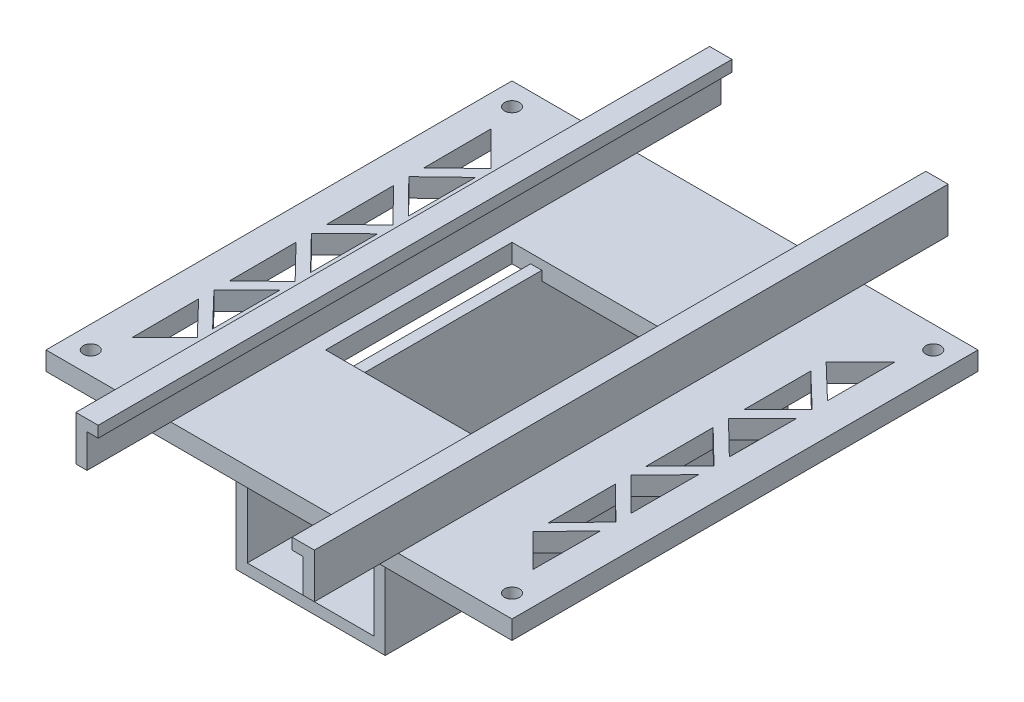
from build123d import *

# Parameters (mm, degrees)
SKETCH_2_W               = 125
SKETCH_2_H               = 125
SKETCH_2_R               = 2
SKETCH_2_W_2             = 50
SKETCH_2_H_2             = 50
EXTRUDE_1_DEPTH          = 2.5
EXTRUDE_4_DEPTH          = 54
CUT_EXTRUDE_2_DEPTH      = 95.702164706
CUT_EXTRUDE_2_DEPTH_BACK = 5
EXTRUDE_7_DEPTH          = 85


with BuildPart() as part:
    # 스케치2 → 보스-돌출1 (new, symmetric)
    with BuildSketch(Plane(origin=(0, 0, 0), x_dir=(1, 0, 0), z_dir=(0, 1, 0))):
        Rectangle(SKETCH_2_W, SKETCH_2_H)
        with Locations((-56.5, 56.5)):
            Circle(SKETCH_2_R, mode=Mode.SUBTRACT)
        with Locations((56.5, 56.5)):
            Circle(SKETCH_2_R, mode=Mode.SUBTRACT)
        with Locations((-56.5, -56.5)):
            Circle(SKETCH_2_R, mode=Mode.SUBTRACT)
        with Locations((56.5, -56.5)):
            Circle(SKETCH_2_R, mode=Mode.SUBTRACT)
        Rectangle(SKETCH_2_W_2, SKETCH_2_H_2, mode=Mode.SUBTRACT)
    extrude(amount=EXTRUDE_1_DEPTH, both=True)

    # 스케치6 → 보스-돌출4 (add, symmetric)
    with BuildSketch(Plane.XY):
        Polygon((-20, 0), (-20, -31.5), (20, -31.5), (20, 0), (17, 0), (17, -28.5), (-17, -28.5), (-17, 0), align=None)
    extrude(amount=EXTRUDE_4_DEPTH, both=True)

    # 스케치8 → 컷-돌출2 (cut, two sides: drawn at the far end of the back side and taken through both)
    with BuildSketch(Plane(origin=(0, 2.5, 0), x_dir=(1, 0, 0), z_dir=(0, 1, 0)).offset(-CUT_EXTRUDE_2_DEPTH_BACK)):
        Polygon((54.07931581, 22.285580831), (54.015526938, 4.28569386), (44.986382589, 13.073341514), align=None)
        Polygon((53.829622097, -48.172767848), (45.041121619, -39.384267369), (53.893419828, -30.170381277), align=None)
        Polygon((45.036831341, -35.272800588), (45.018048518, -17.272810388), (53.90806007, -26.039210725), align=None)
        Polygon((44.95901306, 39.30215881), (54.172270373, 48.515416123), (54.1084815, 30.515529152), align=None)
        Polygon((53.922585518, -21.940432956), (45.013752114, -13.155472476), (53.986361248, -3.944254461), align=None)
        Polygon((45.009460593, -9.042814869), (54.001004771, 0.18784173), (44.99067777, 8.957175331), align=None)
        Polygon((44.982089846, 17.187170851), (54.093962598, 26.418598199), (44.963307022, 35.187161051), align=None)
        Polygon((-53.893419828, -30.170381277), (-53.829622097, -48.172767848), (-45.041121619, -39.384267369), align=None)
        Polygon((-45.009460593, -9.042814869), (-44.99067777, 8.957175331), (-54.001004771, 0.18784173), align=None)
        Polygon((-53.986361248, -3.944254461), (-53.922585518, -21.940432956), (-45.013752114, -13.155472476), align=None)
        Polygon((-44.982089846, 17.187170851), (-44.963307022, 35.187161051), (-54.093962598, 26.418598199), align=None)
        Polygon((-54.1084815, 30.515529152), (-44.95901306, 39.30215881), (-54.172270373, 48.515416123), align=None)
        Polygon((-44.986382589, 13.073341514), (-54.07931581, 22.285580831), (-54.015526938, 4.28569386), align=None)
        Polygon((-53.90806007, -26.039210725), (-45.018048518, -17.272810388), (-45.036831341, -35.272800588), align=None)
    extrude(amount=CUT_EXTRUDE_2_DEPTH + CUT_EXTRUDE_2_DEPTH_BACK, mode=Mode.SUBTRACT)

    # 스케치11 → 보스-돌출7 (add, symmetric)
    with BuildSketch(Plane.XY):
        Polygon((-32, 2.5), (-32, 14.5), (-26, 14.5), (-26, 11.5), (-29, 11.5), (-29, 2.5), align=None)
        Polygon((32, 2.5), (29, 2.5), (29, 11.5), (26, 11.5), (26, 14.5), (32, 14.5), align=None)
    extrude(amount=EXTRUDE_7_DEPTH, both=True)


solid = part.part
